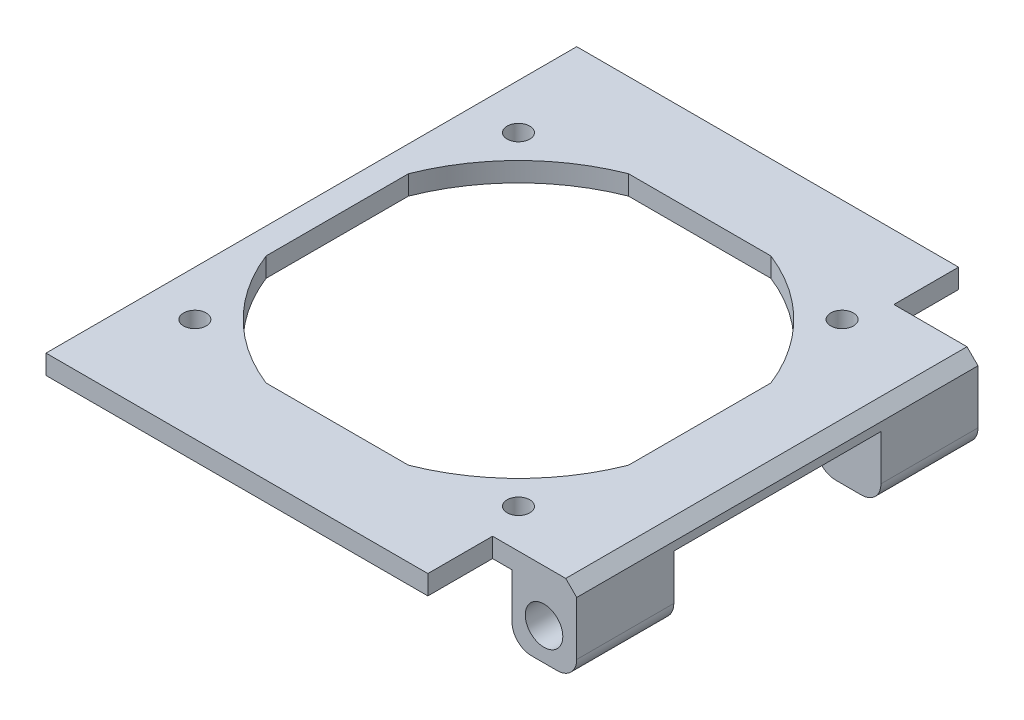
from build123d import *

# Parameters (mm, degrees)
BOSS_EXTRUDE1_DEPTH = 3
SKETCH2_W           = 10
SKETCH2_H           = 15
BOSS_EXTRUDE2_DEPTH = 10
SKETCH4_R           = 1.75
CUT_EXTRUDE1_DEPTH  = 110.895404817
FILLET1_R           = 3
CUT_EXTRUDE4_START  = -15
SKETCH6_R           = 2.9
CUT_EXTRUDE4_DEPTH  = 11
CUT_EXTRUDE5_START  = 36
SKETCH6_2_R         = 2.9
CUT_EXTRUDE5_DEPTH  = 11
CHAMFER1_SIZE       = 1.7
SKETCH9_R           = 3.1
CUT_EXTRUDE7_DEPTH  = 1.5


with BuildPart() as part:
    # Sketch1 → Boss-Extrude1 (new body)
    with BuildSketch(Plane(origin=(0, 0, 0), x_dir=(1, 0, 0), z_dir=(0, 1, 0))):
        Polygon((59, 72), (59, 82), (0, 82), (0, 0), (59, 0), (59, 10), (72, 10), (72, 72), align=None)
    extrude(amount=BOSS_EXTRUDE1_DEPTH)

    # Sketch2 → Boss-Extrude2 (add)
    with BuildSketch(Plane.XZ):
        with Locations((67, -64.5)):
            Rectangle(SKETCH2_W, SKETCH2_H)
        with Locations((67, -17.5)):
            Rectangle(SKETCH2_W, SKETCH2_H)
    extrude(amount=BOSS_EXTRUDE2_DEPTH)

    # Sketch4 → Cut-Extrude1 (cut, through all)
    with BuildSketch(Plane(origin=(0, 3, 0), x_dir=(1, 0, 0), z_dir=(0, 1, 0))):
        with BuildLine():
            Line((4, 52), (4, 30))
            ThreePointArc((4, 30), (10.727952614, 19.727952614), (21, 13))
            Line((21, 13), (43, 13))
            ThreePointArc((43, 13), (53.272047386, 19.727952614), (60, 30))
            Line((60, 30), (60, 52))
            ThreePointArc((60, 52), (53.272047386, 62.272047386), (43, 69))
            Line((43, 69), (21, 69))
            ThreePointArc((21, 69), (10.727952614, 62.272047386), (4, 52))
        make_face()
        with Locations(Location((7, 66, 0), (0, 0, 270))):
            Circle(SKETCH4_R)
        with Locations(Location((57, 66, 0), (0, 0, 270))):
            Circle(SKETCH4_R)
        with Locations(Location((57, 16, 0), (0, 0, 270))):
            Circle(SKETCH4_R)
        with Locations(Location((7, 16, 0), (0, 0, 270))):
            Circle(SKETCH4_R)
    extrude(amount=-CUT_EXTRUDE1_DEPTH, mode=Mode.SUBTRACT)

    # Fillet1
    fillet1_edges = [part.edges().sort_by_distance(p)[0] for p in [
        (72, -10, -64.5),
        (62, -10, -64.5),
        (62, -10, -17.5),
        (72, -10, -17.5),
    ]]
    fillet(fillet1_edges, radius=FILLET1_R)

    # Sketch6 → Cut-Extrude4 (cut)
    with BuildSketch(Plane.XY.offset(-57).offset(CUT_EXTRUDE4_START)):
        with Locations(Location((66.948700041, -5, 0), (0, 0, 180))):
            Circle(SKETCH6_R)
    extrude(amount=CUT_EXTRUDE4_DEPTH, mode=Mode.SUBTRACT)

    # Sketch6<2> → Cut-Extrude5 (cut)
    with BuildSketch(Plane.XY.offset(-57).offset(CUT_EXTRUDE5_START)):
        with Locations(Location((66.948700041, -5, 0), (0, 0, 180))):
            Circle(SKETCH6_2_R)
    extrude(amount=CUT_EXTRUDE5_DEPTH, mode=Mode.SUBTRACT)

    # Chamfer1
    chamfer1_edges = [part.edges().sort_by_distance(p)[0] for p in [
        (72, 3, -41),
    ]]
    chamfer(chamfer1_edges, length=CHAMFER1_SIZE)

    # Sketch9 → Cut-Extrude7 (cut)
    with BuildSketch(Plane.XZ):
        with Locations(Location((5, -5, 0), (0, 0, 270))):
            Circle(SKETCH9_R)
        with Locations(Location((5, -77, 0), (0, 0, 270))):
            Circle(SKETCH9_R)
    extrude(amount=-CUT_EXTRUDE7_DEPTH, mode=Mode.SUBTRACT)


solid = part.part
